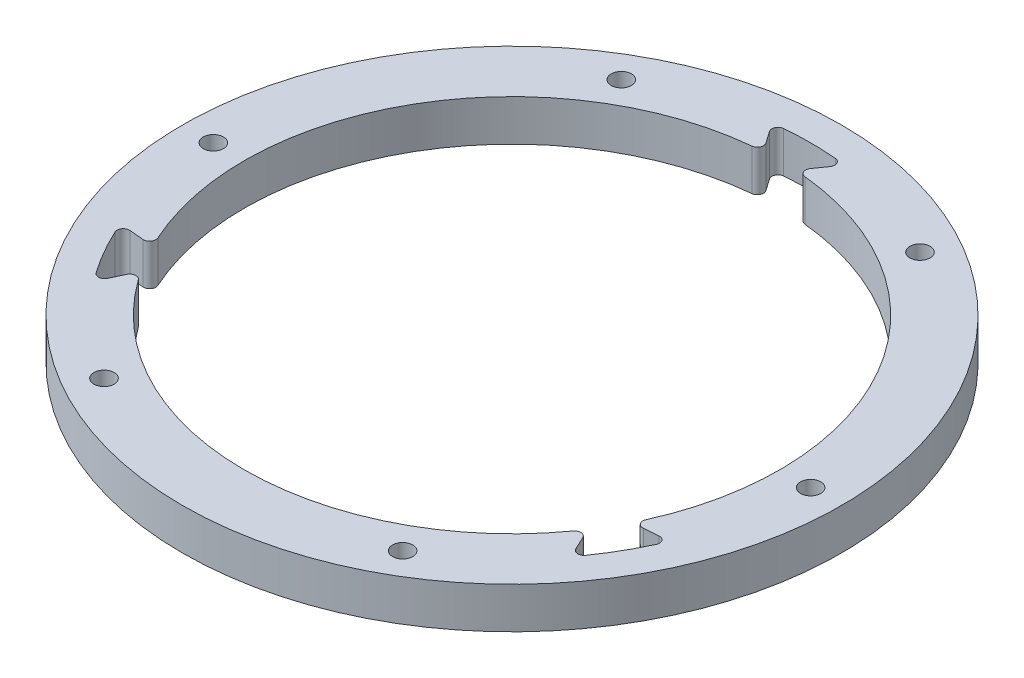
from build123d import *

# Parameters (mm, degrees)
SKETCH2_W                    = 15
SKETCH2_H                    = 10
CUT_EXTRUDE1_DEPTH           = 114.578166916
FILLET1_R                    = 1.5
CIRPATTERN2_COUNT            = 3
FILLET1_OF_CIRPATTERN2_R     = 1.5
F_10_0_1935_DIAMETER_HOLE1_D = 4.9149
CIRPATTERN3_COUNT            = 6


with BuildPart() as part:
    # Sketch2 → Revolve1 (revolve)
    with BuildSketch(Plane(origin=(0, 0, 0), x_dir=(0, 0, -1), z_dir=(1, 0, 0)), mode=Mode.PRIVATE) as revolve1_sk:
        with Locations((-72.5, 5)):
            Rectangle(SKETCH2_W, SKETCH2_H)
    revolve(revolve1_sk.sketch.rotate(Axis((0, -0.75, 0), (0, 1, 0)), 180), axis=Axis((0, -0.75, 0), (0, 1, 0)))

    # Sketch4 → Cut-Extrude1 (cut, through all)
    with BuildSketch(Plane(origin=(0, 10, 0), x_dir=(1, 0, 0), z_dir=(0, 1, 0))):
        with BuildLine():
            Line((-3.881158746, 64.88402428), (-8.835527397, 71.959595994))
            ThreePointArc((-8.835527397, 71.959595994), (0, 72.5), (8.835527397, 71.959595994))
            Line((8.835527397, 71.959595994), (3.881158746, 64.88402428))
            ThreePointArc((3.881158746, 64.88402428), (0, 65), (-3.881158746, 64.88402428))
        make_face()
    cut_extrude1 = extrude(amount=-CUT_EXTRUDE1_DEPTH, mode=Mode.SUBTRACT)

    # Fillet1
    fillet1_edges = [part.edges().sort_by_distance(p)[0] for p in [
        (3.881158746, 5, -64.88402428),
        (-3.881158746, 5, -64.88402428),
        (-8.835527397, 5, -71.959595994),
        (8.835527397, 5, -71.959595994),
    ]]
    fillet(fillet1_edges, radius=FILLET1_R)

    # CirPattern2: Cut-Extrude1 ×3 about axis
    cirpattern2_axis = Axis((0, 0, 0), (0, 1, 0))
    for i in range(1, CIRPATTERN2_COUNT):
        add(cut_extrude1.rotate(cirpattern2_axis, i * 360 / CIRPATTERN2_COUNT), mode=Mode.SUBTRACT)

    # Fillet1 of CirPattern2
    fillet1_of_cirpattern2_edges = [part.edges().sort_by_distance(p)[0] for p in [
        (-58.131792699, 5, 29.08083007),
        (-54.250633954, 5, 35.80319421),
        (-57.901074478, 5, 43.631589179),
        (-66.736601875, 5, 28.328006815),
        (54.250633954, 5, 35.80319421),
        (58.131792699, 5, 29.08083007),
        (66.736601875, 5, 28.328006815),
        (57.901074478, 5, 43.631589179),
    ]]
    fillet(fillet1_of_cirpattern2_edges, radius=FILLET1_OF_CIRPATTERN2_R)

    # #10 (0.1935) Diameter Hole1 (through all)
    with Locations(Plane(origin=(0, 10, 0), x_dir=(1, 0, 0), z_dir=(0, 1, 0))):
        with Locations((-36.25, 62.786841774)):
            f_10_0_1935_diameter_hole1 = Hole(F_10_0_1935_DIAMETER_HOLE1_D / 2)

    # CirPattern3: #10 (0.1935) Diameter Hole1 ×6 about axis
    cirpattern3_axis = Axis((0, 0, 0), (0, 1, 0))
    for i in range(1, CIRPATTERN3_COUNT):
        add(f_10_0_1935_diameter_hole1.rotate(cirpattern3_axis, i * 360 / CIRPATTERN3_COUNT), mode=Mode.SUBTRACT)


solid = part.part
